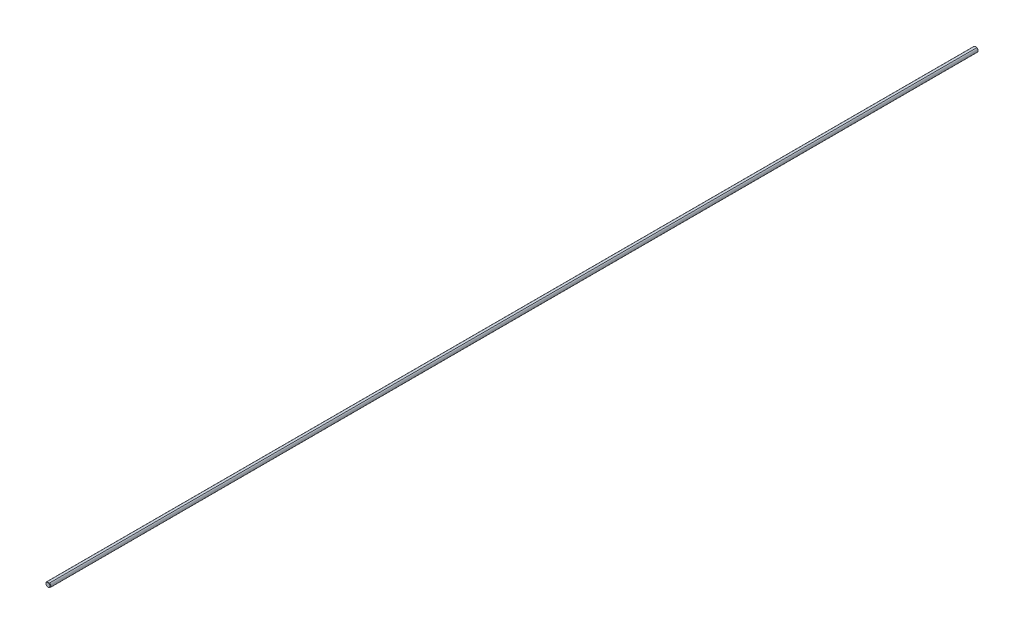
from build123d import *

# Parameters (mm, degrees)
SKETCH1_R           = 3.175
EXTRUDE1_DEPTH      = 609.6
CHAMFER1_SIZE       = 0.635
EXTRUDE7_DEPTH      = 610.616536234
EXTRUDE7_DEPTH_BACK = 610.616536234


with BuildPart() as part:
    # Sketch1 → Extrude1 (new, symmetric)
    with BuildSketch(Plane.XY):
        with Locations(Location((0, 0, 0), (0, 0, 180))):
            Circle(SKETCH1_R)
    extrude(amount=EXTRUDE1_DEPTH, both=True)

    # Chamfer1
    chamfer1_edges = [part.edges().sort_by_distance(p)[0] for p in [
        (3.175, 0, -609.6),
        (3.175, 0, 609.6),
    ]]
    chamfer(chamfer1_edges, length=CHAMFER1_SIZE)

    # Sketch13 → Extrude7 (cut, two sides: drawn at the far end of the back side and taken through both)
    with BuildSketch(Plane.XY.offset(-EXTRUDE7_DEPTH_BACK)):
        with BuildLine():
            Line((-1.5875, 2.749630657), (1.5875, 2.749630657))
            ThreePointArc((1.5875, 2.749630657), (0, 3.175), (-1.5875, 2.749630657))
        make_face()
    extrude(amount=EXTRUDE7_DEPTH + EXTRUDE7_DEPTH_BACK, mode=Mode.SUBTRACT)


solid = part.part
